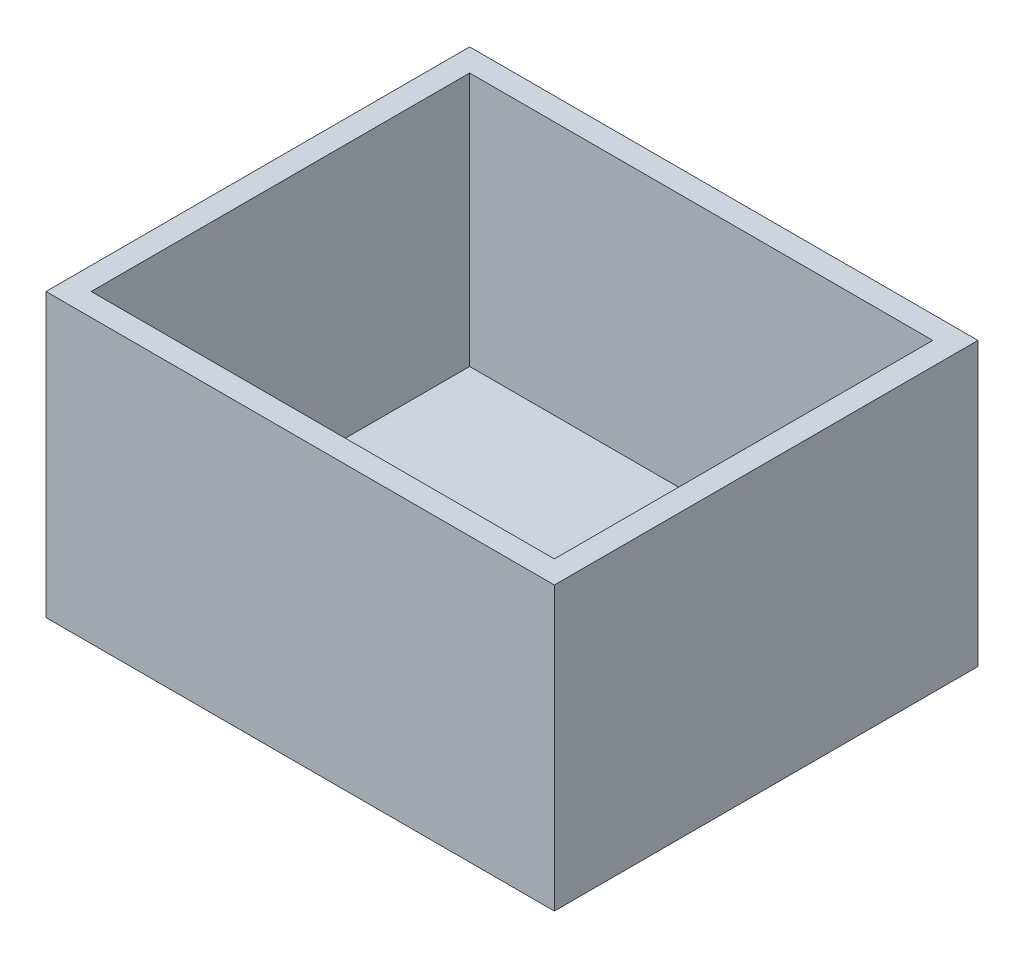
from build123d import *

# Parameters (mm, degrees)
SKETCH1_W           = 90
SKETCH1_H           = 50
BOSS_EXTRUDE1_DEPTH = 75
SKETCH2_W           = 82
SKETCH2_H           = 67
CUT_EXTRUDE1_DEPTH  = 45
SKETCH3_W           = 5
SKETCH3_H           = 5
CUT_EXTRUDE2_DEPTH  = 45
BOSS_EXTRUDE3_DEPTH = 1.5


with BuildPart() as part:
    # Sketch1 → Boss-Extrude1 (new body)
    with BuildSketch(Plane.XY):
        Rectangle(SKETCH1_W, SKETCH1_H)
    extrude(amount=BOSS_EXTRUDE1_DEPTH)

    # Sketch2 → Cut-Extrude1 (cut)
    with BuildSketch(Plane(origin=(0, 25, 0), x_dir=(1, 0, 0), z_dir=(0, 1, 0))):
        with Locations((0, -37.5)):
            Rectangle(SKETCH2_W, SKETCH2_H)
    extrude(amount=-CUT_EXTRUDE1_DEPTH, mode=Mode.SUBTRACT)

    # Sketch3 → Cut-Extrude2 (cut)
    with BuildSketch(Plane(origin=(0, -20, 0), x_dir=(1, 0, 0), z_dir=(0, 1, 0))):
        with Locations((0.622357421, -68.5)):
            Rectangle(SKETCH3_W, SKETCH3_H)
    extrude(amount=-CUT_EXTRUDE2_DEPTH, mode=Mode.SUBTRACT)

    # Sketch5 → Boss-Extrude3 (add)
    # profile 1 of 9: a face of its own
    with BuildSketch(Plane(origin=(0, 0, 0), x_dir=(-1, 0, 0), z_dir=(0, 0, -1))):
        Polygon((-4.931178649, 18.51211871), (-3.181494154, 18.51211871), (-0.361073981, 7.39961871), (-2.413502868, 7.39961871), (-3.027895897, 9.821573838), (-7.359811962, 9.821573838), (-8.659831994, 7.39961871), (-10.903702187, 7.39961871), align=None)
        Polygon((-3.502047038, 11.673657171), (-4.419184458, 15.291007432), (-6.362536321, 11.673657171), align=None, mode=Mode.SUBTRACT)
    # profile 2 of 9: a face of its own
    with BuildSketch(Plane(origin=(0, 0, 0), x_dir=(-1, 0, 0), z_dir=(0, 0, -1))):
        with BuildLine():
            add(Edge.make_bspline(
                [(2.203349095, 9.821573838), (2.288507775, 9.817900952), (2.456062207, 9.810674344), (2.695690049, 9.735121835), (2.917566533, 9.617503254), (3.111710926, 9.452870726), (3.27729203, 9.258412214), (3.400225705, 9.038259103), (3.471435198, 8.794456382), (3.480768805, 8.6258989), (3.485560634, 8.5393623)],
                knots=[0, 0, 0, 0, 1.011829643, 1.990831015, 2.96394547, 3.98733706, 5.003945692, 5.993273531, 6.969756284, 8, 8, 8, 8], degree=3))
            add(Edge.make_bspline(
                [(3.485560634, 8.5393623), (3.480637373, 8.454334105), (3.470966643, 8.287313772), (3.400346423, 8.044811808), (3.276565259, 7.824674409), (3.112650134, 7.62787703), (2.91676017, 7.464233535), (2.696806503, 7.342291413), (2.455427781, 7.271689716), (2.288387464, 7.262055456), (2.203349095, 7.257150761)],
                knots=[0, 0, 0, 0, 1.013694729, 1.991193998, 2.981551723, 4.006008661, 5.030465598, 6.008806002, 6.986305271, 8, 8, 8, 8], degree=3))
            add(Edge.make_bspline(
                [(2.203349095, 7.257150761), (2.117587155, 7.262084616), (1.949125326, 7.271776166), (1.706000433, 7.341760796), (1.485581559, 7.464360989), (1.28963103, 7.627238022), (1.127681065, 7.824820747), (1.006727088, 8.045384418), (0.935607905, 8.287254606), (0.926019107, 8.454314145), (0.921137557, 8.5393623)],
                knots=[0, 0, 0, 0, 1.02155614, 2.006638561, 2.984070978, 4.007577129, 5.025452526, 6.010654007, 6.987246069, 8, 8, 8, 8], degree=3))
            add(Edge.make_bspline(
                [(0.921137557, 8.5393623), (0.925886546, 8.625919305), (0.935136708, 8.794516532), (1.006848067, 9.0376875), (1.126958506, 9.258254903), (1.290572262, 9.453518036), (1.484776276, 9.617371775), (1.707114994, 9.735652137), (1.94849387, 9.810592751), (2.117467021, 9.81787339), (2.203349095, 9.821573838)],
                knots=[0, 0, 0, 0, 1.029295292, 2.004879113, 2.989063463, 3.999073543, 5.021523017, 5.993741641, 6.980301721, 8, 8, 8, 8], degree=3))
        make_face()
    # profile 3 of 9: a face of its own
    with BuildSketch(Plane(origin=(0, 0, 0), x_dir=(-1, 0, 0), z_dir=(0, 0, -1))):
        with BuildLine():
            Line((7.038355105, 18.51211871), (8.939411796, 18.51211871))
            add(Edge.make_bspline(
                [(8.939411796, 18.51211871), (9.078188601, 18.511553507), (9.345450213, 18.510465017), (9.730680179, 18.494147075), (10.084854453, 18.47047299), (10.407098742, 18.437318176), (10.697348606, 18.396956554), (10.954754098, 18.34216118), (11.182557411, 18.283737009), (11.319526253, 18.228532017), (11.383627541, 18.202696134)],
                knots=[0, 0, 0, 0, 1.344208059, 2.588726621, 3.734329264, 4.782131975, 5.726482068, 6.570895881, 7.331180631, 8, 8, 8, 8], degree=3))
            add(Edge.make_bspline(
                [(11.383627541, 18.202696134), (11.455362978, 18.170328233), (11.596758533, 18.106528842), (11.796536939, 17.994926124), (11.982526228, 17.873525011), (12.156473593, 17.745007745), (12.317106274, 17.606552911), (12.465358804, 17.459274947), (12.598580782, 17.300782141), (12.719408764, 17.133501309), (12.825724004, 16.957402772), (12.920185629, 16.775019728), (12.99748788, 16.584579789), (13.063359181, 16.387969068), (13.11157514, 16.182102395), (13.146535794, 15.969388571), (13.170378843, 15.749370462), (13.172368687, 15.600494194), (13.173381147, 15.52474391)],
                knots=[0, 0, 0, 0, 1.101151138, 2.170445781, 3.198860437, 4.208379212, 5.195204417, 6.164605257, 7.130047863, 8.089887807, 9.049952485, 10.006809717, 10.961522665, 11.923831799, 12.906274987, 13.917075149, 14.940179313, 16, 16, 16, 16], degree=3))
            add(Edge.make_bspline(
                [(13.173381147, 15.52474391), (13.171477928, 15.441584825), (13.167697349, 15.276396581), (13.143384998, 15.032227853), (13.100893054, 14.794059127), (13.039843386, 14.562376599), (12.965219334, 14.334755423), (12.870581367, 14.114436465), (12.76194782, 13.899367714), (12.634268055, 13.693756991), (12.496061939, 13.495614187), (12.341199617, 13.312946597), (12.176169462, 13.144120827), (12.001841763, 12.985441125), (11.812341163, 12.845120197), (11.614308487, 12.71433552), (11.403045231, 12.600834326), (11.177604981, 12.498560781), (10.925837821, 12.41037964), (10.641577513, 12.333735148), (10.318939738, 12.267228016), (9.959206936, 12.212910475), (9.561183657, 12.168410108), (9.125983919, 12.136758845), (8.652511776, 12.111149346), (8.324312295, 12.104512774), (8.153612016, 12.101061018)],
                knots=[0, 0, 0, 0, 0.866399648, 1.721027061, 2.553550129, 3.384204618, 4.21539855, 5.04677222, 5.880012857, 6.723270778, 7.566245156, 8.394738354, 9.214784533, 10.025005932, 10.847562629, 11.668810448, 12.495570546, 13.343317016, 14.245569203, 15.271435576, 16.408570332, 17.675782105, 19.060520395, 20.580184572, 22.221315141, 24, 24, 24, 24], degree=3))
            Line((8.153612016, 12.101061018), (7.492471692, 7.39961871))
            Line((7.492471692, 7.39961871), (5.480111916, 7.39961871))
            Line((5.480111916, 7.39961871), (7.038355105, 18.51211871))
        make_face()
        with BuildLine():
            add(Edge.make_bspline(
                [(8.411835173, 13.953144351), (8.549120441, 13.955478583), (8.810446613, 13.959921857), (9.18410329, 13.976134589), (9.520489097, 14.007509788), (9.820231262, 14.048124984), (10.082743081, 14.101517404), (10.308927649, 14.163602611), (10.496914809, 14.241369524), (10.652555357, 14.329023351), (10.776065008, 14.433393141), (10.885531395, 14.542801154), (10.977062438, 14.665719546), (11.050611614, 14.801043262), (11.109434327, 14.946432043), (11.148756724, 15.104564869), (11.173493456, 15.273161591), (11.177026233, 15.389607333), (11.178829865, 15.449057812)],
                knots=[0, 0, 0, 0, 1.839895187, 3.502289619, 5.0101303, 6.365671836, 7.553232357, 8.598057788, 9.502875839, 10.27370316, 10.980290013, 11.662314044, 12.34441055, 13.025273935, 13.721358838, 14.440015487, 15.203561875, 16, 16, 16, 16], degree=3))
            add(Edge.make_bspline(
                [(11.178829865, 15.449057812), (11.176128827, 15.51524694), (11.170862374, 15.644301762), (11.134091748, 15.829850654), (11.067117028, 15.998120698), (10.979002925, 16.15071712), (10.863202572, 16.283985611), (10.723339589, 16.396789581), (10.557953613, 16.486196339), (10.400635182, 16.54130369), (10.254468689, 16.576478178), (10.117345215, 16.597310606), (9.956357488, 16.617655733), (9.770588149, 16.632023668), (9.561385559, 16.64600245), (9.326809216, 16.654467454), (9.067794618, 16.658258357), (8.886729456, 16.659427093), (8.792491724, 16.660035376)],
                knots=[0, 0, 0, 0, 1.03742853, 2.022766538, 2.947121861, 3.864647693, 4.771646501, 5.697975149, 6.666071958, 7.703435297, 8.301453266, 9.020359131, 9.87578453, 10.844509861, 11.939964187, 13.162010635, 14.522931311, 16, 16, 16, 16], degree=3))
            Line((8.792491724, 16.660035376), (8.411835173, 13.953144351))
        make_face(mode=Mode.SUBTRACT)
    # profile 4 of 9: a face of its own
    with BuildSketch(Plane(origin=(0, 0, 0), x_dir=(-1, 0, 0), z_dir=(0, 0, -1))):
        with BuildLine():
            add(Edge.make_bspline(
                [(15.02546448, 9.821573838), (15.11062316, 9.817900952), (15.278177592, 9.810674344), (15.517805433, 9.735121835), (15.739681918, 9.617503254), (15.93382631, 9.452870726), (16.099407415, 9.258412214), (16.22234109, 9.038259103), (16.293550583, 8.794456382), (16.30288419, 8.6258989), (16.307676019, 8.5393623)],
                knots=[0, 0, 0, 0, 1.011829643, 1.990831015, 2.96394547, 3.98733706, 5.003945692, 5.993273531, 6.969756284, 8, 8, 8, 8], degree=3))
            add(Edge.make_bspline(
                [(16.307676019, 8.5393623), (16.302752758, 8.454334105), (16.293082028, 8.287313772), (16.222461808, 8.044811808), (16.098680644, 7.824674409), (15.934765519, 7.62787703), (15.738875554, 7.464233535), (15.518921888, 7.342291413), (15.277543166, 7.271689716), (15.110502849, 7.262055456), (15.02546448, 7.257150761)],
                knots=[0, 0, 0, 0, 1.013694729, 1.991193998, 2.981551723, 4.006008661, 5.030465598, 6.008806002, 6.986305271, 8, 8, 8, 8], degree=3))
            add(Edge.make_bspline(
                [(15.02546448, 7.257150761), (14.93970254, 7.262084616), (14.77124071, 7.271776166), (14.528115818, 7.341760796), (14.307696944, 7.464360989), (14.111746415, 7.627238022), (13.949796449, 7.824820747), (13.828842473, 8.045384418), (13.75772329, 8.287254606), (13.748134492, 8.454314145), (13.743252942, 8.5393623)],
                knots=[0, 0, 0, 0, 1.02155614, 2.006638561, 2.984070978, 4.007577129, 5.025452526, 6.010654007, 6.987246069, 8, 8, 8, 8], degree=3))
            add(Edge.make_bspline(
                [(13.743252942, 8.5393623), (13.74800193, 8.625919305), (13.757252092, 8.794516532), (13.828963452, 9.0376875), (13.94907389, 9.258254903), (14.112687647, 9.453518036), (14.306891661, 9.617371775), (14.529230379, 9.735652137), (14.770609255, 9.810592751), (14.939582405, 9.81787339), (15.02546448, 9.821573838)],
                knots=[0, 0, 0, 0, 1.029295292, 2.004879113, 2.989063463, 3.999073543, 5.021523017, 5.993741641, 6.980301721, 8, 8, 8, 8], degree=3))
        make_face()
    # profile 5 of 9: a face of its own
    with BuildSketch(Plane(origin=(0, 0, 0), x_dir=(-1, 0, 0), z_dir=(0, 0, -1))):
        with BuildLine():
            Line((-15.896758577, -3.123473237), (-17.441645396, -4.470240565))
            add(Edge.make_bspline(
                [(-17.441645396, -4.470240565), (-17.518855174, -4.365942061), (-17.666826291, -4.1660559), (-17.90162609, -3.897954697), (-18.126572919, -3.664977981), (-18.353159313, -3.479189059), (-18.574016533, -3.331869198), (-18.791069177, -3.225153708), (-19.005537318, -3.157717889), (-19.148596416, -3.149650208), (-19.218042631, -3.145733854)],
                knots=[0, 0, 0, 0, 1.358515141, 2.603569235, 3.730126198, 4.746094498, 5.666493297, 6.504166865, 7.273866877, 8, 8, 8, 8], degree=3))
            add(Edge.make_bspline(
                [(-19.218042631, -3.145733854), (-19.283640513, -3.148573783), (-19.409793982, -3.154035345), (-19.590878896, -3.200598576), (-19.75546143, -3.275498402), (-19.896762128, -3.383850236), (-20.014776301, -3.508775419), (-20.102403424, -3.648964781), (-20.153436326, -3.803484355), (-20.160510222, -3.910388951), (-20.164118853, -3.964924559)],
                knots=[0, 0, 0, 0, 1.130304997, 2.173727141, 3.204821236, 4.229135679, 5.225705988, 6.15679035, 7.05971714, 8, 8, 8, 8], degree=3))
            add(Edge.make_bspline(
                [(-20.164118853, -3.964924559), (-20.160832394, -4.01864981), (-20.153919977, -4.13165023), (-20.103275977, -4.302957151), (-20.026670229, -4.483455154), (-19.934529916, -4.640398401), (-19.831076193, -4.782907764), (-19.722663171, -4.922352106), (-19.581104545, -5.08907496), (-19.408851598, -5.284985167), (-19.207549945, -5.511735699), (-18.971978478, -5.766027307), (-18.706378756, -6.049530066), (-18.517728671, -6.247524559), (-18.418886481, -6.3512627)],
                knots=[0, 0, 0, 0, 0.642317819, 1.35098826, 2.122816345, 2.986294386, 3.520967692, 4.229638134, 5.099348126, 6.137609051, 7.351336444, 8.727500291, 10.285391505, 12, 12, 12, 12], degree=3))
            add(Edge.make_bspline(
                [(-18.418886481, -6.3512627), (-18.365267126, -6.406729262), (-18.262382, -6.513158817), (-18.118020538, -6.668595698), (-17.989174967, -6.812656169), (-17.870213211, -6.94029472), (-17.768374335, -7.058101737), (-17.681423149, -7.163250853), (-17.607606843, -7.254262471), (-17.563965869, -7.311348758), (-17.544044234, -7.337408033)],
                knots=[0, 0, 0, 0, 1.403722598, 2.693470914, 3.859630393, 4.920438112, 5.867965235, 6.69256451, 7.40316977, 8, 8, 8, 8], degree=3))
            add(Edge.make_bspline(
                [(-17.544044234, -7.337408033), (-17.464715056, -7.447002261), (-17.31171272, -7.658376857), (-17.113257328, -7.979756257), (-16.949112568, -8.289399154), (-16.820127834, -8.590970138), (-16.723638725, -8.887767661), (-16.653754542, -9.184697788), (-16.609733056, -9.484230376), (-16.604850598, -9.685756985), (-16.602420135, -9.786075902)],
                knots=[0, 0, 0, 0, 1.215130546, 2.343624586, 3.390252636, 4.360992906, 5.286454858, 6.190345157, 7.099163061, 8, 8, 8, 8], degree=3))
            add(Edge.make_bspline(
                [(-16.602420135, -9.786075902), (-16.605444565, -9.896799806), (-16.611396657, -10.114705005), (-16.657518063, -10.434412881), (-16.729355712, -10.740961467), (-16.836476544, -11.03250907), (-16.968744623, -11.31222824), (-17.136620924, -11.576022955), (-17.329741016, -11.828356611), (-17.552687077, -12.063267929), (-17.796705119, -12.278093257), (-18.062413785, -12.46412483), (-18.343267617, -12.622692084), (-18.642121647, -12.753235539), (-18.958065188, -12.852524538), (-19.290534608, -12.923145545), (-19.638916166, -12.970023516), (-19.877541138, -12.973994574), (-19.999390288, -12.976022316)],
                knots=[0, 0, 0, 0, 1.018989505, 2.005376454, 2.968035412, 3.912365187, 4.859556873, 5.811049809, 6.78527381, 7.780773345, 8.787785161, 9.773320145, 10.761314359, 11.752515283, 12.770107012, 13.804505292, 14.878913802, 16, 16, 16, 16], degree=3))
            add(Edge.make_bspline(
                [(-19.999390288, -12.976022316), (-20.092934291, -12.974147977), (-20.278113338, -12.970437549), (-20.552582582, -12.945802164), (-20.820396928, -12.903746357), (-21.081162811, -12.843056704), (-21.335424713, -12.767277049), (-21.583579037, -12.67631657), (-21.825004862, -12.566219511), (-22.060011374, -12.43984873), (-22.288620296, -12.296709992), (-22.509459889, -12.135095933), (-22.724912867, -11.958123131), (-22.932155332, -11.762439862), (-23.135562901, -11.553447667), (-23.331572922, -11.32639221), (-23.518215842, -11.080321848), (-23.636696997, -10.908480396), (-23.696878769, -10.821194591)],
                knots=[0, 0, 0, 0, 1.003438088, 1.986398949, 2.953471805, 3.909242729, 4.856156023, 5.798037682, 6.742035895, 7.700024963, 8.658509928, 9.632892881, 10.633707184, 11.647385023, 12.688779161, 13.761077638, 14.862753205, 16, 16, 16, 16], degree=3))
            Line((-23.696878769, -10.821194591), (-22.051819174, -9.527852745))
            add(Edge.make_bspline(
                [(-22.051819174, -9.527852745), (-21.969881194, -9.65384292), (-21.812729358, -9.895484067), (-21.556579115, -10.221656796), (-21.295435012, -10.498867234), (-21.028348841, -10.726037548), (-20.754461332, -10.902793535), (-20.475738538, -11.029140132), (-20.190939999, -11.110406068), (-19.99768504, -11.119440041), (-19.901443573, -11.123938982)],
                knots=[0, 0, 0, 0, 1.289844872, 2.473840458, 3.555310637, 4.554525788, 5.477014656, 6.343795492, 7.175205895, 8, 8, 8, 8], degree=3))
            add(Edge.make_bspline(
                [(-19.901443573, -11.123938982), (-19.812644229, -11.120047324), (-19.639779506, -11.112471475), (-19.392497326, -11.041935093), (-19.1656253, -10.933198691), (-18.969213287, -10.777940191), (-18.803749929, -10.595599452), (-18.683472846, -10.387874307), (-18.611063097, -10.160275443), (-18.601739188, -10.002529081), (-18.596971417, -9.921865665)],
                knots=[0, 0, 0, 0, 1.07813582, 2.098795369, 3.104167493, 4.120866408, 5.124778177, 6.083335831, 7.019916046, 8, 8, 8, 8], degree=3))
            add(Edge.make_bspline(
                [(-18.596971417, -9.921865665), (-18.599249098, -9.856302416), (-18.603882321, -9.722934681), (-18.652179252, -9.524298047), (-18.723859886, -9.322881397), (-18.810738917, -9.15265389), (-18.904443588, -9.00338676), (-19.003677756, -8.8682148), (-19.128542794, -8.709554543), (-19.283018398, -8.531130033), (-19.460790056, -8.326917664), (-19.668593549, -8.1040944), (-19.899789449, -7.855286365), (-20.065790137, -7.685052985), (-20.152988545, -7.59563119)],
                knots=[0, 0, 0, 0, 0.82235112, 1.672813781, 2.554588539, 3.50524042, 4.06657461, 4.767804758, 5.610876414, 6.602916144, 7.732569792, 9.01260869, 10.430754915, 12, 12, 12, 12], degree=3))
            add(Edge.make_bspline(
                [(-20.152988545, -7.59563119), (-20.245279216, -7.500178115), (-20.423691842, -7.315652059), (-20.676097928, -7.045599404), (-20.903455816, -6.794249026), (-21.105508069, -6.561336444), (-21.282421589, -6.346442975), (-21.437257596, -6.151198847), (-21.565329667, -5.973028503), (-21.637561524, -5.857427331), (-21.671162623, -5.803651523)],
                knots=[0, 0, 0, 0, 1.354401886, 2.618275412, 3.770529779, 4.811580489, 5.763301005, 6.60974666, 7.35327647, 8, 8, 8, 8], degree=3))
            add(Edge.make_bspline(
                [(-21.671162623, -5.803651523), (-21.746187476, -5.66965037), (-21.891748642, -5.409664998), (-22.041811412, -5.00047235), (-22.139601431, -4.596536749), (-22.152385015, -4.326817769), (-22.158670135, -4.194208914)],
                knots=[0, 0, 0, 0, 1.081804801, 2.098888081, 3.065307629, 4, 4, 4, 4], degree=3))
            add(Edge.make_bspline(
                [(-22.158670135, -4.194208914), (-22.156413357, -4.108773947), (-22.151924204, -3.938827835), (-22.119605763, -3.688009733), (-22.070121251, -3.442748016), (-21.991234779, -3.206762878), (-21.900255923, -2.97414524), (-21.781335263, -2.751007367), (-21.647727465, -2.531346132), (-21.540538053, -2.395271078), (-21.486399502, -2.326543149)],
                knots=[0, 0, 0, 0, 1.012167245, 2.013389743, 2.992947912, 3.971795425, 4.958040075, 5.949133471, 6.964161297, 8, 8, 8, 8], degree=3))
            add(Edge.make_bspline(
                [(-21.486399502, -2.326543149), (-21.414931927, -2.243712753), (-21.273972111, -2.08034136), (-21.03008487, -1.871506289), (-20.77149658, -1.691120298), (-20.492640987, -1.546306706), (-20.196724692, -1.430888589), (-19.880933315, -1.352569668), (-19.547687033, -1.301404248), (-19.319154687, -1.296271456), (-19.202460199, -1.293650521)],
                knots=[0, 0, 0, 0, 1.010152455, 1.992384693, 2.959065588, 3.919519142, 4.890305168, 5.888624478, 6.921877408, 8, 8, 8, 8], degree=3))
            add(Edge.make_bspline(
                [(-19.202460199, -1.293650521), (-19.041089583, -1.299284208), (-18.72276243, -1.31039748), (-18.254455948, -1.396775082), (-17.808187196, -1.543192497), (-17.379492972, -1.742124322), (-16.975333895, -2.004106038), (-16.590312286, -2.320793649), (-16.224640607, -2.694444427), (-16.008088899, -2.97779915), (-15.896758577, -3.123473237)],
                knots=[0, 0, 0, 0, 0.984438778, 1.941949542, 2.894274057, 3.844399604, 4.817935388, 5.825099055, 6.88187249, 8, 8, 8, 8], degree=3))
        make_face()
    # profile 6 of 9: a face of its own
    with BuildSketch(Plane(origin=(0, 0, 0), x_dir=(-1, 0, 0), z_dir=(0, 0, -1))):
        Polygon((-13.47702951, -1.578586418), (-11.464669735, -1.578586418), (-13.022912924, -12.691086418), (-15.035272699, -12.691086418), align=None)
    # profile 7 of 9: a face of its own
    with BuildSketch(Plane(origin=(0, 0, 0), x_dir=(-1, 0, 0), z_dir=(0, 0, -1))):
        Polygon((-9.216347419, -1.578586418), (-7.34422953, -1.578586418), (-3.424134879, -9.133839824), (-2.36452951, -1.578586418), (-0.352169735, -1.578586418), (-1.908186862, -12.691086418), (-3.764722319, -12.691086418), (-7.69817334, -5.05346873), (-8.766682956, -12.691086418), (-10.779042731, -12.691086418), align=None)
    # profile 8 of 9: a face of its own
    with BuildSketch(Plane(origin=(0, 0, 0), x_dir=(-1, 0, 0), z_dir=(0, 0, -1))):
        with BuildLine():
            Line((11.704180426, -3.604302564), (9.934461375, -4.71288129))
            add(Edge.make_bspline(
                [(9.934461375, -4.71288129), (9.808944411, -4.575774181), (9.569161371, -4.31384975), (9.193060685, -3.971387679), (8.822571209, -3.69559071), (8.451954525, -3.485630146), (8.072776188, -3.329708995), (7.674443395, -3.224805798), (7.252809774, -3.158094693), (6.963669851, -3.149917314), (6.815748935, -3.145733854)],
                knots=[0, 0, 0, 0, 1.232977487, 2.355435308, 3.369770187, 4.291348691, 5.174604885, 6.082334442, 7.018942652, 8, 8, 8, 8], degree=3))
            add(Edge.make_bspline(
                [(6.815748935, -3.145733854), (6.655137714, -3.149991024), (6.339479589, -3.158357875), (5.879091589, -3.237533056), (5.440428888, -3.358625296), (5.025368435, -3.534019887), (4.633659423, -3.760972897), (4.264831867, -4.036665882), (3.918627874, -4.361366254), (3.714438997, -4.608833518), (3.610220089, -4.735141907)],
                knots=[0, 0, 0, 0, 1.037106879, 2.038283569, 3.009830787, 3.972569298, 4.94146214, 5.928319872, 6.942605276, 8, 8, 8, 8], degree=3))
            add(Edge.make_bspline(
                [(3.610220089, -4.735141907), (3.531929924, -4.840727371), (3.37727143, -5.04930643), (3.179855978, -5.381248628), (3.009742749, -5.719274156), (2.870288945, -6.066765723), (2.763585047, -6.423042709), (2.688223473, -6.788807223), (2.639509573, -7.16246255), (2.633682293, -7.415170433), (2.630752942, -7.542205709)],
                knots=[0, 0, 0, 0, 1.040960542, 2.056368018, 3.055559505, 4.03710588, 5.019268411, 5.998275661, 6.99374091, 8, 8, 8, 8], degree=3))
            add(Edge.make_bspline(
                [(2.630752942, -7.542205709), (2.633750489, -7.666251421), (2.63965981, -7.910793313), (2.68621445, -8.269773994), (2.768252127, -8.612599631), (2.875823665, -8.941874788), (3.0198761, -9.254615185), (3.194238213, -9.552228141), (3.400338399, -9.833907453), (3.635609203, -10.097305396), (3.893036458, -10.337788981), (4.167874811, -10.548570068), (4.457443294, -10.725986687), (4.761858014, -10.871266055), (5.080929507, -10.985614356), (5.415440105, -11.064914686), (5.763471675, -11.11594033), (6.000828733, -11.12124727), (6.121217685, -11.123938982)],
                knots=[0, 0, 0, 0, 1.066897471, 2.103265977, 3.106535126, 4.095591644, 5.078159493, 6.062322472, 7.058152725, 8.075375883, 9.096057735, 10.084186963, 11.049730852, 12.011871914, 12.980953841, 13.959387168, 14.96498868, 16, 16, 16, 16], degree=3))
            add(Edge.make_bspline(
                [(6.121217685, -11.123938982), (6.211809802, -11.122260543), (6.391166805, -11.118937517), (6.656737264, -11.091444186), (6.916280826, -11.046788162), (7.169452332, -10.985077147), (7.416224995, -10.903935144), (7.657119123, -10.805579564), (7.892799005, -10.690655384), (8.120638954, -10.555777722), (8.341003968, -10.405284069), (8.550778756, -10.23540794), (8.749493106, -10.047202227), (8.938739973, -9.841658131), (9.119755425, -9.619871613), (9.286084115, -9.377209003), (9.445153632, -9.119025134), (9.540763989, -8.93705809), (9.589421812, -8.844451803)],
                knots=[0, 0, 0, 0, 0.990751711, 1.961520103, 2.916931976, 3.869720035, 4.809138875, 5.755683625, 6.713987145, 7.674487982, 8.649319602, 9.630449541, 10.623757948, 11.640402946, 12.684918653, 13.752145235, 14.856026455, 16, 16, 16, 16], degree=3))
            Line((9.589421812, -8.844451803), (6.081148575, -8.844451803))
            Line((6.081148575, -8.844451803), (6.334919608, -6.99236847))
            Line((6.334919608, -6.99236847), (12.033637557, -6.99236847))
            add(Edge.make_bspline(
                [(12.033637557, -6.99236847), (12.019383129, -7.216063216), (11.991508007, -7.653507534), (11.89063021, -8.290478554), (11.741226168, -8.891187542), (11.547563851, -9.457948997), (11.307688029, -9.989705818), (11.017870684, -10.485016701), (10.683790424, -10.945743913), (10.302412368, -11.365847665), (9.884801867, -11.742801001), (9.438766284, -12.075828942), (8.960918983, -12.352070239), (8.457629894, -12.580262163), (7.926918199, -12.759737923), (7.367434575, -12.885562221), (6.780094103, -12.963119671), (6.378942264, -12.971668538), (6.174643166, -12.976022316)],
                knots=[0, 0, 0, 0, 1.148955532, 2.246830018, 3.301660101, 4.319666133, 5.314146826, 6.287838685, 7.257462643, 8.227280698, 9.191724348, 10.138440807, 11.076252923, 12.016254752, 12.968042649, 13.943717582, 14.952773983, 16, 16, 16, 16], degree=3))
            add(Edge.make_bspline(
                [(6.174643166, -12.976022316), (6.062563383, -12.974910936), (5.841142222, -12.972715329), (5.514190475, -12.950160215), (5.196425696, -12.911652422), (4.888047569, -12.861071895), (4.587696496, -12.796422643), (4.296916692, -12.716810343), (4.015033422, -12.621112497), (3.74381031, -12.507728325), (3.477472061, -12.388096076), (3.224285231, -12.245580565), (2.97802519, -12.092608626), (2.742563941, -11.922569173), (2.514352167, -11.739981488), (2.296846926, -11.541924353), (2.088145012, -11.329182375), (1.957680895, -11.178090838), (1.891700458, -11.101678365)],
                knots=[0, 0, 0, 0, 1.111499042, 2.195841241, 3.24834816, 4.285223882, 5.294222847, 6.294054786, 7.273859608, 8.244193736, 9.208986092, 10.167555097, 11.123181443, 12.083077344, 13.046240314, 14.020501641, 14.998895854, 16, 16, 16, 16], degree=3))
            add(Edge.make_bspline(
                [(1.891700458, -11.101678365), (1.791406288, -10.975013613), (1.592276212, -10.723525794), (1.336645981, -10.318307568), (1.118496884, -9.895706803), (0.943800103, -9.453564331), (0.804137782, -8.995292554), (0.706644393, -8.518373049), (0.647990219, -8.023767341), (0.640163794, -7.687801848), (0.63620166, -7.517719031)],
                knots=[0, 0, 0, 0, 0.999328569, 1.984127054, 2.959716786, 3.938705326, 4.922250225, 5.921072174, 6.947541011, 8, 8, 8, 8], degree=3))
            add(Edge.make_bspline(
                [(0.63620166, -7.517719031), (0.641523699, -7.309624698), (0.652025387, -6.899003618), (0.742575714, -6.295294371), (0.883422584, -5.711925126), (1.088360547, -5.151817273), (1.347064135, -4.611792194), (1.666657724, -4.095993411), (2.03940038, -3.598682528), (2.468547006, -3.133398151), (2.933937417, -2.703385082), (3.428109103, -2.325661877), (3.946296158, -2.007721715), (4.484270816, -1.744429635), (5.047168269, -1.544238732), (5.630041023, -1.399353295), (6.235673202, -1.309571329), (6.647000219, -1.299011444), (6.855818046, -1.293650521)],
                knots=[0, 0, 0, 0, 1.022519879, 2.01768214, 2.99445506, 3.968403767, 4.944092992, 5.933246428, 6.946641619, 7.994936793, 9.040543676, 10.058341478, 11.047494914, 12.024771785, 12.997483176, 13.978673844, 14.973836105, 16, 16, 16, 16], degree=3))
            add(Edge.make_bspline(
                [(6.855818046, -1.293650521), (7.012543529, -1.29619041), (7.324622371, -1.30124795), (7.788514141, -1.356029706), (8.247362665, -1.436537229), (8.696723582, -1.555754324), (9.133645066, -1.701151982), (9.552192974, -1.875210706), (9.948329415, -2.077377915), (10.324989463, -2.30967283), (10.685913154, -2.574761707), (11.037922937, -2.87756869), (11.379916881, -3.222467791), (11.594535635, -3.475190937), (11.704180426, -3.604302564)],
                knots=[0, 0, 0, 0, 1.014010841, 2.019144067, 3.019687909, 4.027399918, 5.025300219, 5.998481464, 6.958680332, 7.901091373, 8.859847597, 9.854378501, 10.903841272, 12, 12, 12, 12], degree=3))
        make_face()
    # profile 9 of 9: a face of its own
    with BuildSketch(Plane(origin=(0, 0, 0), x_dir=(-1, 0, 0), z_dir=(0, 0, -1))):
        Polygon((15.159028182, -1.578586418), (17.171387958, -1.578586418), (16.572577361, -5.85262488), (20.261161595, -5.85262488), (20.857746131, -1.578586418), (22.870105906, -1.578586418), (21.311862717, -12.691086418), (19.299502942, -12.691086418), (19.998486315, -7.704708213), (16.312128142, -7.704708213), (15.613144769, -12.691086418), (13.600784993, -12.691086418), align=None)
    extrude(amount=BOSS_EXTRUDE3_DEPTH)


solid = part.part
